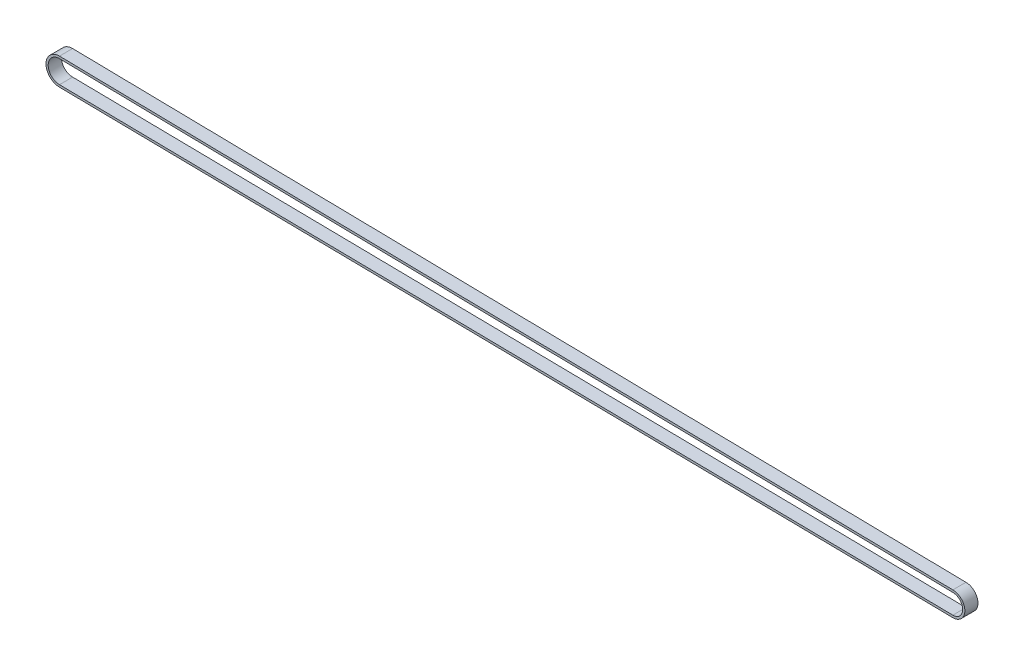
from build123d import *

# Parameters (mm, degrees)
BOSS_EXTRUDE1_DEPTH = 6


with BuildPart() as part:
    # Sketch1 → Boss-Extrude1 (new body)
    with BuildSketch(Plane.XY):
        with BuildLine():
            ThreePointArc((407.937859821, -11.970570506), (413.437859821, -6.470570506), (407.937859821, -0.970570506))
            Line((407.937859821, -0.970570506), (0.214631564, 6.146253598))
            Line((0.214631564, 6.146253598), (0, 6.15))
            ThreePointArc((0, 6.15), (-6.15, 0), (0, -6.15))
            Line((0, -6.15), (407.780940717, -11.968331541))
            Line((407.780940717, -11.968331541), (407.937859821, -11.970570506))
        make_face()
        with BuildLine():
            ThreePointArc((0, -5.15), (-5.15, 0), (0, 5.15))
            ThreePointArc((0, 5.15), (0.08987975, 5.149215633), (0.179732122, 5.146862769))
            Line((0.179732122, 5.146862769), (407.937859821, -1.970570506))
            ThreePointArc((407.937859821, -1.970570506), (412.437859821, -6.470570506), (407.937859821, -10.970570506))
            Line((407.937859821, -10.970570506), (0, -5.15))
        make_face(mode=Mode.SUBTRACT)
    extrude(amount=BOSS_EXTRUDE1_DEPTH)


solid = part.part
